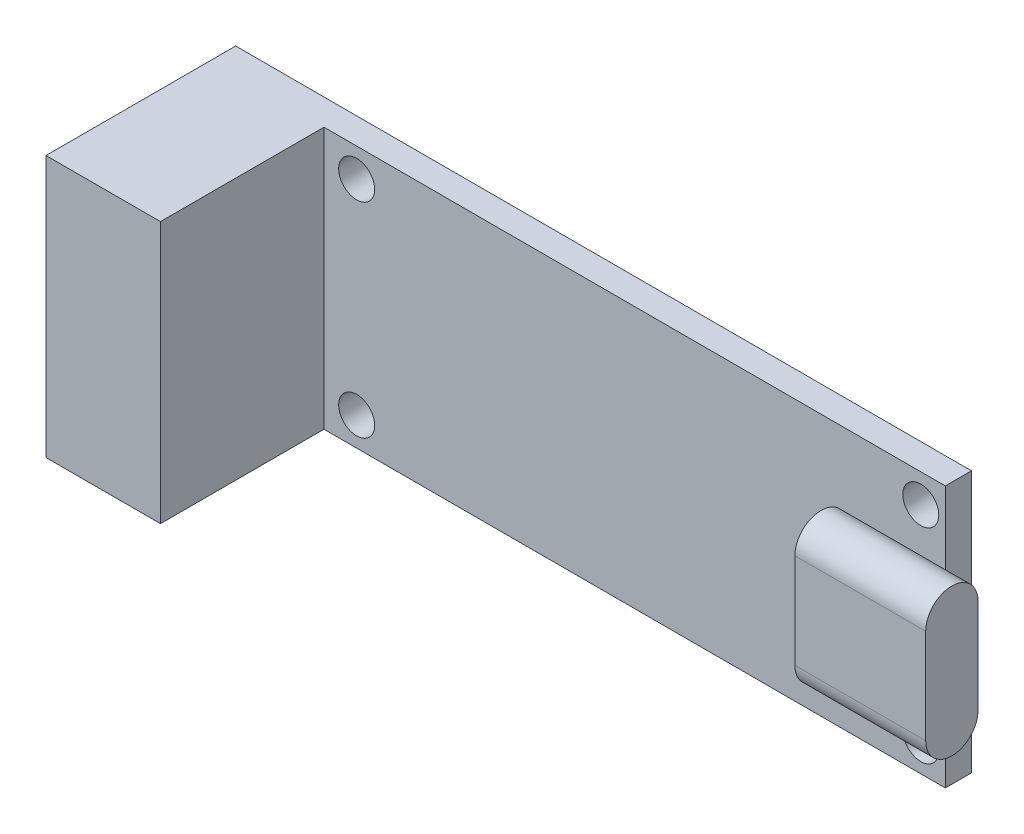
from build123d import *

# Parameters (mm, degrees)
SKETCH1_W                = 45
SKETCH1_H                = 16
SKETCH1_R                = 1.1
BOSS_EXTRUDE1_DEPTH      = 1.6
BOSS_EXTRUDE2_DEPTH      = 2
BOSS_EXTRUDE2_DEPTH_BACK = 6
SKETCH3_W                = 7
SKETCH3_H                = 16
BOSS_EXTRUDE3_DEPTH      = 10


with BuildPart() as part:
    # Sketch1 → Boss-Extrude1 (new body)
    with BuildSketch(Plane.XY):
        with Locations((22.5, 8)):
            Rectangle(SKETCH1_W, SKETCH1_H)
        with Locations((9, 14.25)):
            Circle(SKETCH1_R, mode=Mode.SUBTRACT)
        with Locations((9, 1.75)):
            Circle(SKETCH1_R, mode=Mode.SUBTRACT)
        with Locations((43.5, 14.25)):
            Circle(SKETCH1_R, mode=Mode.SUBTRACT)
        with Locations((43.5, 1.75)):
            Circle(SKETCH1_R, mode=Mode.SUBTRACT)
    extrude(amount=BOSS_EXTRUDE1_DEPTH)

    # Sketch2 → Boss-Extrude2 (add, two sides: drawn at the far end of the back side and taken through both)
    with BuildSketch(Plane(origin=(45, 0, 0), x_dir=(0, 0, -1), z_dir=(1, 0, 0)).offset(-BOSS_EXTRUDE2_DEPTH_BACK)):
        with BuildLine():
            Line((-1.6, 10.9), (-1.6, 5.1))
            ThreePointArc((-1.6, 5.1), (-3.2, 3.5), (-4.8, 5.1))
            Line((-4.8, 5.1), (-4.8, 10.9))
            ThreePointArc((-4.8, 10.9), (-3.2, 12.5), (-1.6, 10.9))
        make_face()
    extrude(amount=BOSS_EXTRUDE2_DEPTH + BOSS_EXTRUDE2_DEPTH_BACK)

    # Sketch3 → Boss-Extrude3 (add)
    with BuildSketch(Plane.XY.offset(1.6)):
        with Locations((3.5, 8)):
            Rectangle(SKETCH3_W, SKETCH3_H)
    extrude(amount=BOSS_EXTRUDE3_DEPTH)


solid = part.part
